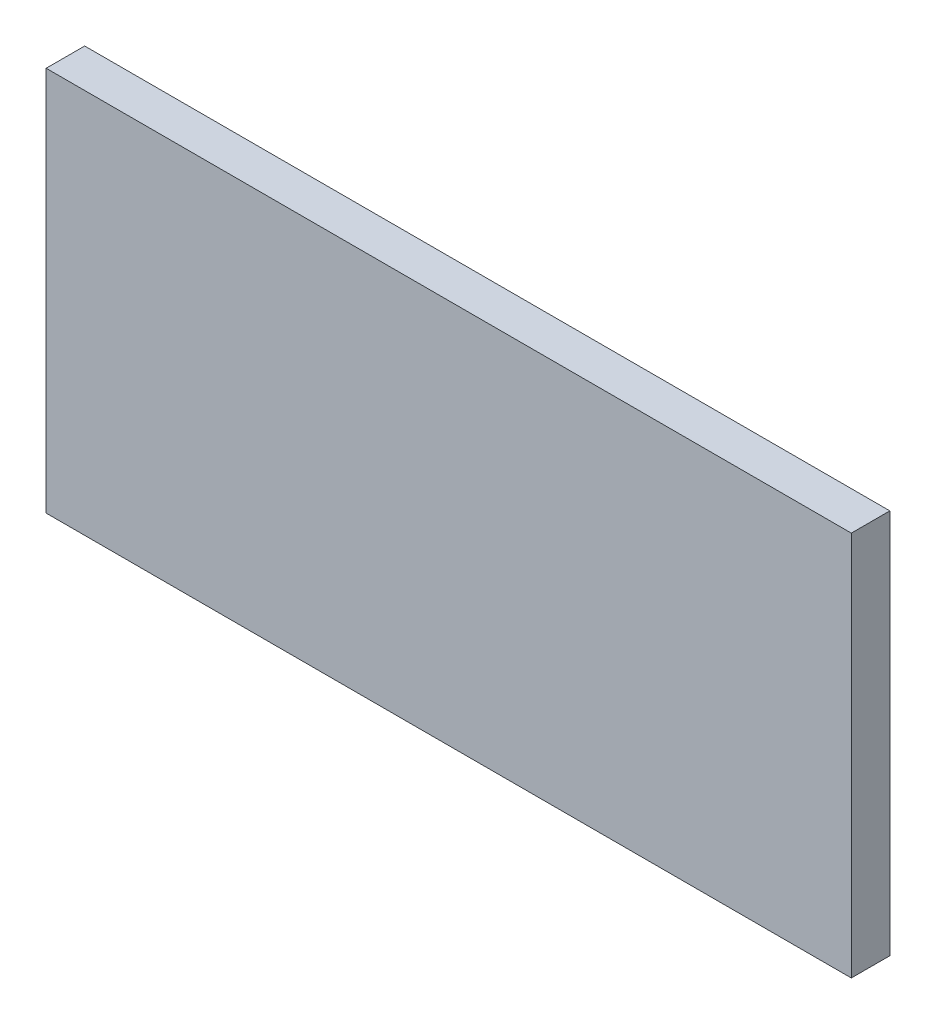
from build123d import *

# Parameters (mm, degrees)
SKETCH1_W           = 66.34988
SKETCH1_H           = 31.75
BOSS_EXTRUDE1_DEPTH = 3.175


with BuildPart() as part:
    # Sketch1 → Boss-Extrude1 (new body)
    with BuildSketch(Plane.XY):
        Rectangle(SKETCH1_W, SKETCH1_H)
    extrude(amount=BOSS_EXTRUDE1_DEPTH)


solid = part.part
